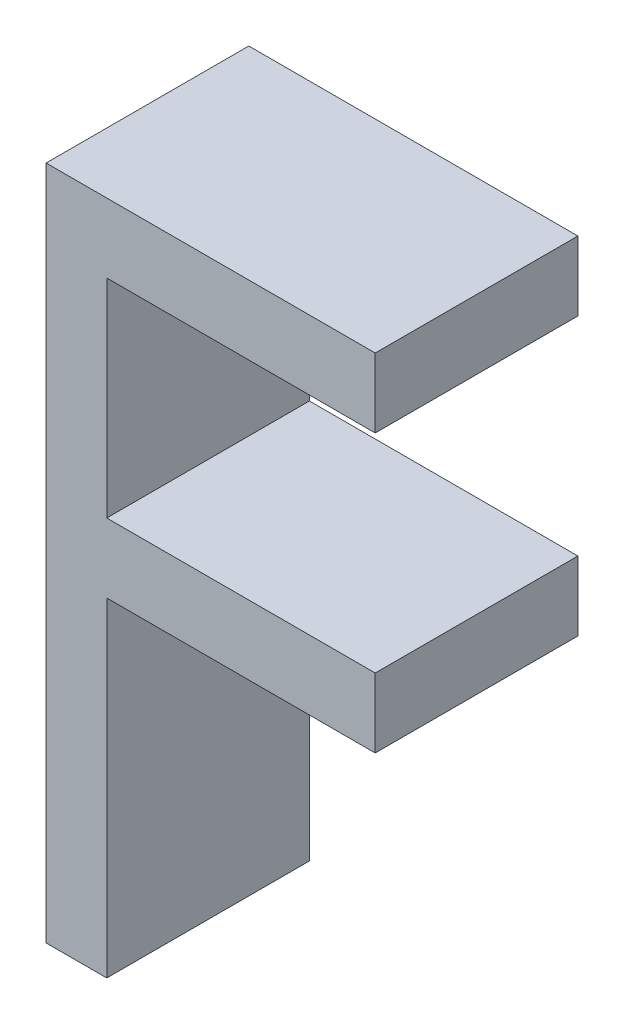
from build123d import *

# Parameters (mm, degrees)
BOSS_EXTRU_1_DEPTH = 1.5


with BuildPart() as part:
    # Esquisse1 → Boss.-Extru.1 (new body)
    with BuildSketch(Plane.XY):
        Polygon((-55.432465326, -17.870119076), (-52.99656789, -17.870119076), (-52.99656789, -18.382939589), (-54.983747377, -18.382939589), (-54.983747377, -19.921401128), (-52.99656789, -19.921401128), (-52.99656789, -20.43422164), (-54.983747377, -20.43422164), (-54.983747377, -22.870119076), (-55.432465326, -22.870119076), align=None)
    extrude(amount=BOSS_EXTRU_1_DEPTH)


solid = part.part
